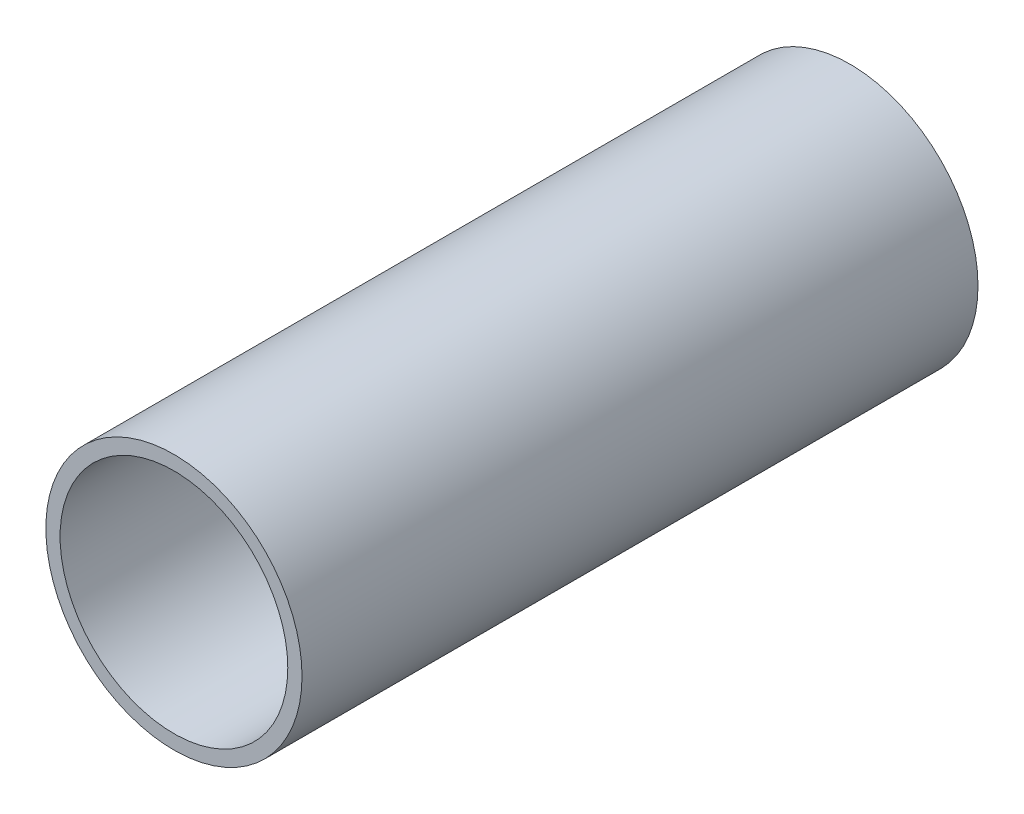
from build123d import *

# Parameters (mm, degrees)
SKETCH1_R           = 57.15
BOSS_EXTRUDE1_DEPTH = 150.8125
SKETCH2_R           = 50.8
CUT_EXTRUDE1_DEPTH  = 313.265729187


with BuildPart() as part:
    # Sketch1 → Boss-Extrude1 (new, symmetric)
    with BuildSketch(Plane.XY):
        Circle(SKETCH1_R)
    extrude(amount=BOSS_EXTRUDE1_DEPTH, both=True)

    # Sketch2 → Cut-Extrude1 (cut, through all)
    with BuildSketch(Plane.XY.offset(150.8125)):
        Circle(SKETCH2_R)
    extrude(amount=-CUT_EXTRUDE1_DEPTH, mode=Mode.SUBTRACT)


solid = part.part
